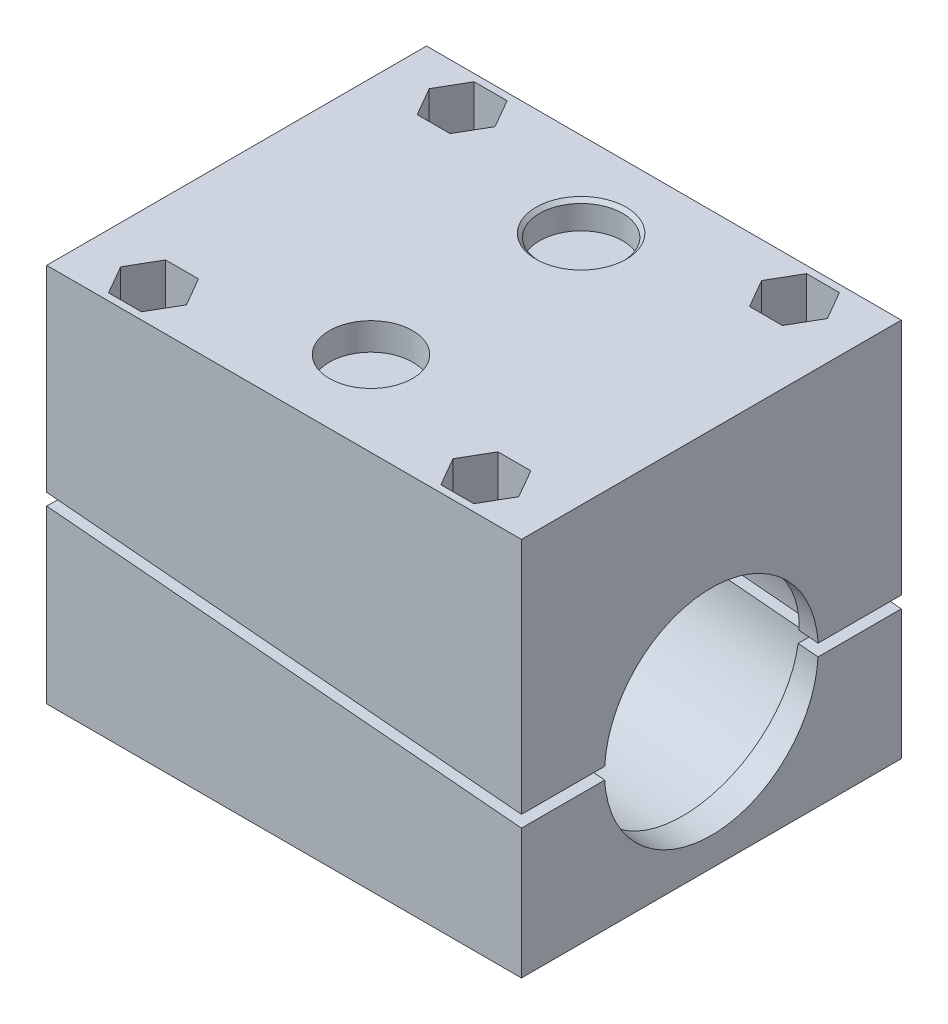
from build123d import *

# Parameters (mm, degrees)
SKETCH1_W              = 40
SKETCH1_H              = 32
BOSS_EXTRUDE1_DEPTH    = 32
SKETCH2_R              = 10.1
CUT_EXTRUDE1_DEPTH     = 40
SKETCH3_R              = 1.75
CUT_EXTRUDE2_DEPTH     = 41.987803064
CUT_EXTRUDE3_DEPTH     = 13
SPLIT2_SURFACE_1_BACK  = 61.399
SPLIT2_SURFACE_1_DEPTH = 122.798
SKETCH10_R             = 3.5
CUT_EXTRUDE5_DEPTH     = 2.3
CUT_EXTRUDE6_START     = -2.3
SKETCH11_R             = 3.5
CUT_EXTRUDE6_DEPTH     = 2.3
SKETCH12_R             = 9
CUT_EXTRUDE7_DEPTH     = 55.536602893
CHAMFER3_SIZE          = 0.3
CHAMFER4_SIZE          = 0.3


with BuildPart() as part:
    # Sketch1 → Boss-Extrude1 (new body)
    with BuildSketch(Plane(origin=(0, 0, 0), x_dir=(1, 0, 0), z_dir=(0, 1, 0))):
        Rectangle(SKETCH1_W, SKETCH1_H)
    extrude(amount=BOSS_EXTRUDE1_DEPTH)

    # Sketch2 → Cut-Extrude1 (cut)
    with BuildSketch(Plane(origin=(-22.626448373, 1.979557728, 0), x_dir=(0, 0, 1), z_dir=(-0.9961946980917455, 0.08715574274765836, 0))):
        with Locations(Location((0, 13.135115484, 0), (0, 0, 270))):
            Circle(SKETCH2_R)
    extrude(amount=-CUT_EXTRUDE1_DEPTH, mode=Mode.SUBTRACT)

    # Sketch3 → Cut-Extrude2 (cut, through all)
    with BuildSketch(Plane(origin=(0, 0, 0), x_dir=(1, 0, 0), z_dir=(0, 1, 0))):
        with Locations(Location((-14, 13, 0), (0, 0, 270))):
            Circle(SKETCH3_R)
        with Locations(Location((14, 13, 0), (0, 0, 270))):
            Circle(SKETCH3_R)
        with Locations(Location((14, -13, 0), (0, 0, 90))):
            Circle(SKETCH3_R)
        with Locations(Location((-14, -13, 0), (0, 0, 90))):
            Circle(SKETCH3_R)
    extrude(amount=CUT_EXTRUDE2_DEPTH, mode=Mode.SUBTRACT)

    # Sketch7 → Cut-Extrude3 (cut)
    with BuildSketch(Plane(origin=(0, 32, 0), x_dir=(1, 0, 0), z_dir=(0, 1, 0))):
        Polygon((-11.228718708, 13), (-12.614359354, 15.4), (-15.385640646, 15.4), (-16.771281292, 13), (-15.385640646, 10.6), (-12.614359354, 10.6), align=None)
        Polygon((16.771281292, 13), (15.385640646, 15.4), (12.614359354, 15.4), (11.228718708, 13), (12.614359354, 10.6), (15.385640646, 10.6), align=None)
        Polygon((16.771281292, -13), (15.385640646, -10.6), (12.614359354, -10.6), (11.228718708, -13), (12.614359354, -15.4), (15.385640646, -15.4), align=None)
        Polygon((-11.228718708, -13), (-12.614359354, -10.6), (-15.385640646, -10.6), (-16.771281292, -13), (-15.385640646, -15.4), (-12.614359354, -15.4), align=None)
    extrude(amount=-CUT_EXTRUDE3_DEPTH, mode=Mode.SUBTRACT)

    # Split2: cut with a surface, the side behind it stays
    # Split2 surface: a surface, the sketch's curves swept straight by 122.798 mm
    with BuildLine(Plane.XY.offset(-SPLIT2_SURFACE_1_BACK), mode=Mode.PRIVATE) as split2_surface_1_path:
        Line((31.826155364, 9.898951774), (31.913311107, 10.895146473))
        Line((31.913311107, 10.895146473), (-21.438069755, 15.562787481))
        Line((-21.438069755, 15.562787481), (-21.525225498, 14.566592783))
        Line((-21.525225498, 14.566592783), (31.826155364, 9.898951774))
    split2_surface_1 = Shell.extrude(split2_surface_1_path.wire(), (0 * SPLIT2_SURFACE_1_DEPTH, 0 * SPLIT2_SURFACE_1_DEPTH, 1 * SPLIT2_SURFACE_1_DEPTH))
    split(bisect_by=split2_surface_1, keep=Keep.BOTTOM)

    # Sketch10 → Cut-Extrude5 (cut)
    with BuildSketch(Plane(origin=(0, 0, 0), x_dir=(1, 0, 0), z_dir=(0, 1, 0))):
        with Locations(Location((0.172645806, -8.851363161, 0), (0, 0, 270))):
            Circle(SKETCH10_R)
        with Locations(Location((0.172645806, 8.851363161, 0), (0, 0, 270))):
            Circle(SKETCH10_R)
    extrude(amount=CUT_EXTRUDE5_DEPTH, mode=Mode.SUBTRACT)

    # Sketch11 → Cut-Extrude6 (cut)
    with BuildSketch(Plane(origin=(0, 32, 0), x_dir=(1, 0, 0), z_dir=(0, 1, 0)).offset(CUT_EXTRUDE6_START)):
        with Locations(Location((0.172645806, -8.851363161, 0), (0, 0, 270))):
            Circle(SKETCH11_R)
        with Locations(Location((0.172645806, 8.851363161, 0), (0, 0, 270))):
            Circle(SKETCH11_R)
    extrude(amount=CUT_EXTRUDE6_DEPTH, mode=Mode.SUBTRACT)

    # Sketch12 → Cut-Extrude7 (cut, through all)
    with BuildSketch(Plane(origin=(-22.626448373, 1.979557728, 0), x_dir=(0, 0, 1), z_dir=(-0.9961946980917455, 0.08715574274765836, 0))):
        with Locations((0, 13.135115484)):
            Circle(SKETCH12_R)
    extrude(amount=-CUT_EXTRUDE7_DEPTH, mode=Mode.SUBTRACT)

    # Chamfer3
    chamfer3_edges = [part.edges().sort_by_distance(p)[0] for p in [
        (0.172645806, 32, -12.351363161),
    ]]
    chamfer(chamfer3_edges, length=CHAMFER3_SIZE)

    # Chamfer4
    chamfer4_edges = [part.edges().sort_by_distance(p)[0] for p in [
        (0.172645806, 0, -12.351363161),
    ]]
    chamfer(chamfer4_edges, length=CHAMFER4_SIZE)


solid = part.part
